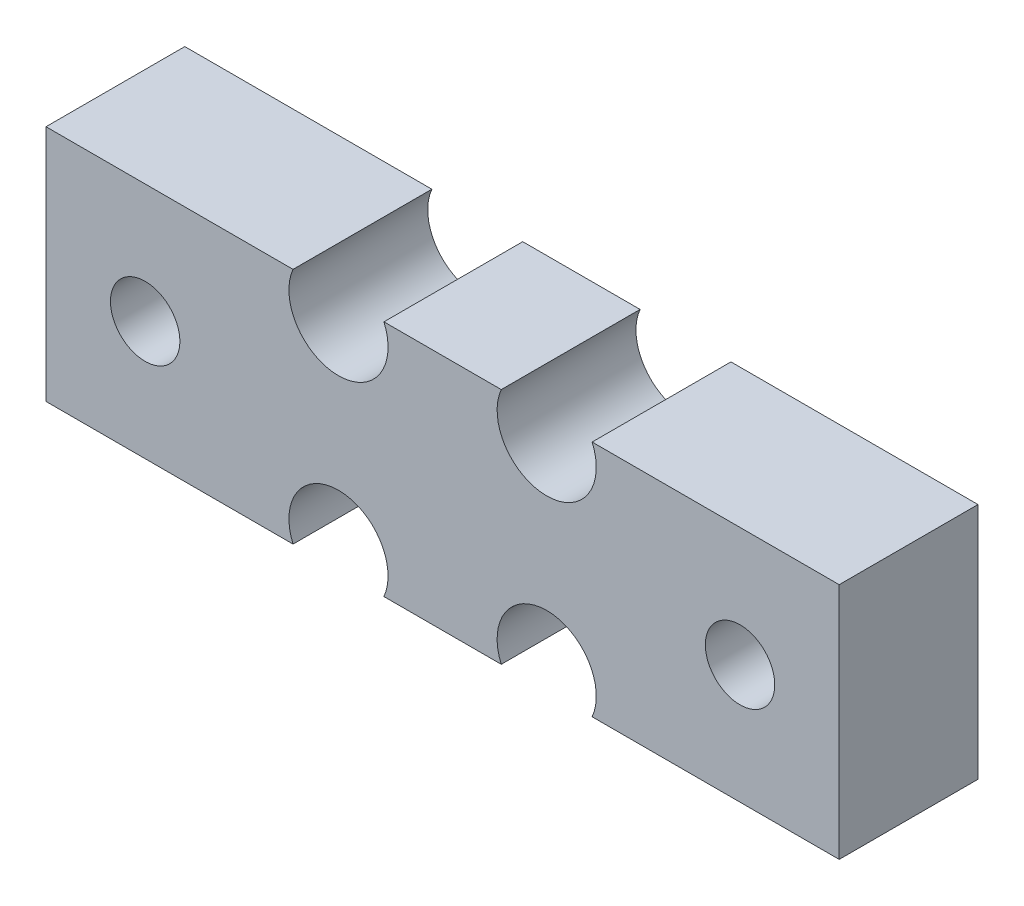
from build123d import *

# Parameters (mm, degrees)
SKETCH1_W           = 40
SKETCH1_H           = 12
BOSS_EXTRUDE1_DEPTH = 7
SKETCH2_R           = 2.5
SKETCH2_R_2         = 1.75
CUT_EXTRUDE1_DEPTH  = 7


with BuildPart() as part:
    # Sketch1 → Boss-Extrude1 (new body)
    with BuildSketch(Plane.XY):
        Rectangle(SKETCH1_W, SKETCH1_H)
    extrude(amount=BOSS_EXTRUDE1_DEPTH)

    # Sketch2 → Cut-Extrude1 (cut)
    with BuildSketch(Plane(origin=(0, 0, 0), x_dir=(-1, 0, 0), z_dir=(0, 0, -1))):
        with Locations((-5.25, 5)):
            Circle(SKETCH2_R)
        with Locations((5.25, 5)):
            Circle(SKETCH2_R)
        with Locations((-5.25, -5)):
            Circle(SKETCH2_R)
        with Locations((5.25, -5)):
            Circle(SKETCH2_R)
        with Locations((-15, 0)):
            Circle(SKETCH2_R_2)
        with Locations((15, 0)):
            Circle(SKETCH2_R_2)
    extrude(amount=-CUT_EXTRUDE1_DEPTH, mode=Mode.SUBTRACT)


solid = part.part
